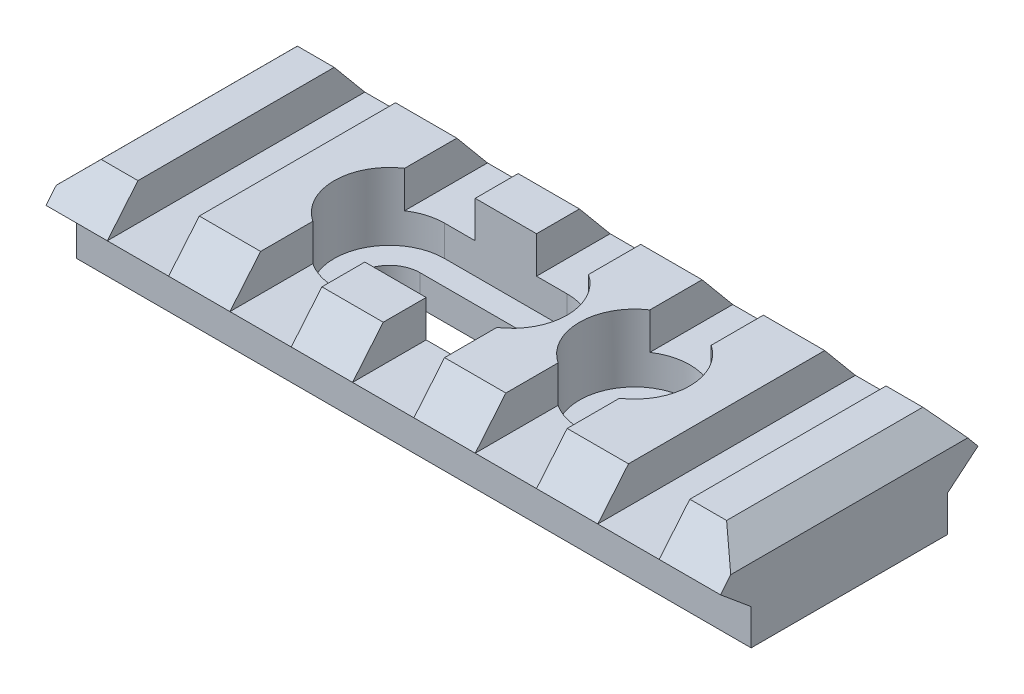
from build123d import *

# Parameters (mm, degrees)
EXTRUDE_1_DEPTH                  = 27.5
SKETCH_2_W                       = 5
SKETCH_2_H                       = 21
CUT_EXTRUDE_1_DEPTH              = 3
PATTERN_LINEAR_1_COUNT           = 3
PATTERN_LINEAR_1_PITCH           = 10
PATTERN_LINEAR_2_COPY_1_SKETCH_W = 5
PATTERN_LINEAR_2_COPY_1_SKETCH_H = 21
PATTERN_LINEAR_2_COPY_1_DEPTH    = 3
PATTERN_LINEAR_2_COPY_2_SKETCH_W = 5
PATTERN_LINEAR_2_COPY_2_SKETCH_H = 21
PATTERN_LINEAR_2_COPY_2_DEPTH    = 3
PATTERN_LINEAR_2_COPY_3_SKETCH_W = 5
PATTERN_LINEAR_2_COPY_3_SKETCH_H = 21
PATTERN_LINEAR_2_COPY_3_DEPTH    = 3
PATTERN_LINEAR_2_COPY_4_SKETCH_W = 5
PATTERN_LINEAR_2_COPY_4_SKETCH_H = 21
PATTERN_LINEAR_2_COPY_4_DEPTH    = 3
PATTERN_LINEAR_2_COPY_5_SKETCH_W = 5
PATTERN_LINEAR_2_COPY_5_SKETCH_H = 21
PATTERN_LINEAR_2_COPY_5_DEPTH    = 3
PATTERN_LINEAR_2_COPY_6_SKETCH_W = 5
PATTERN_LINEAR_2_COPY_6_SKETCH_H = 21
PATTERN_LINEAR_2_COPY_6_DEPTH    = 3
CUT_EXTRUDE_2_DEPTH              = 31.504098085
CUT_EXTRUDE_2_DEPTH_BACK         = 55
SKETCH_3_R                       = 2.5
CUT_EXTRUDE_3_DEPTH              = 31.504098085
SKETCH_5_R                       = 4.5
CUT_EXTRUDE_4_DEPTH              = 5.5


with BuildPart() as part:
    # 草图1 → 凸台-拉伸1 (new, symmetric)
    with BuildSketch(Plane(origin=(0, 0, 0), x_dir=(0, 0, -1), z_dir=(1, 0, 0))):
        Polygon((-8, 0), (8, 0), (8, 2.916666667), (10.5, 5), (8, 8), (-8, 8), (-10.5, 5), (-8, 2.916666667), align=None)
    extrude(amount=EXTRUDE_1_DEPTH, both=True)

    # 草图2 → 切除-拉伸1 (cut)
    with BuildSketch(Plane(origin=(0, 8, 0), x_dir=(1, 0, 0), z_dir=(0, 1, 0))):
        Rectangle(SKETCH_2_W, SKETCH_2_H)
    cut_extrude_1 = extrude(amount=-CUT_EXTRUDE_1_DEPTH, mode=Mode.SUBTRACT)

    # 阵列(线性)1: 切除-拉伸1 ×3
    with Locations(*[(i * PATTERN_LINEAR_1_PITCH, 0, 0) for i in range(1, PATTERN_LINEAR_1_COUNT)]):
        add(cut_extrude_1, mode=Mode.SUBTRACT)

    # 阵列(线性)2 copy 1 sketch → 阵列(线性)2 copy 1 (cut)
    with BuildSketch(Plane(origin=(0, 8, 0), x_dir=(1, 0, 0), z_dir=(0, 1, 0))):
        Rectangle(PATTERN_LINEAR_2_COPY_1_SKETCH_W, PATTERN_LINEAR_2_COPY_1_SKETCH_H)
    extrude(amount=-PATTERN_LINEAR_2_COPY_1_DEPTH, mode=Mode.SUBTRACT)

    # 阵列(线性)2 copy 2 sketch → 阵列(线性)2 copy 2 (cut)
    with BuildSketch(Plane(origin=(-10, 8, 0), x_dir=(1, 0, 0), z_dir=(0, 1, 0))):
        Rectangle(PATTERN_LINEAR_2_COPY_2_SKETCH_W, PATTERN_LINEAR_2_COPY_2_SKETCH_H)
    extrude(amount=-PATTERN_LINEAR_2_COPY_2_DEPTH, mode=Mode.SUBTRACT)

    # 阵列(线性)2 copy 3 sketch → 阵列(线性)2 copy 3 (cut)
    with BuildSketch(Plane(origin=(10, 8, 0), x_dir=(1, 0, 0), z_dir=(0, 1, 0))):
        Rectangle(PATTERN_LINEAR_2_COPY_3_SKETCH_W, PATTERN_LINEAR_2_COPY_3_SKETCH_H)
    extrude(amount=-PATTERN_LINEAR_2_COPY_3_DEPTH, mode=Mode.SUBTRACT)

    # 阵列(线性)2 copy 4 sketch → 阵列(线性)2 copy 4 (cut)
    with BuildSketch(Plane(origin=(0, 8, 0), x_dir=(1, 0, 0), z_dir=(0, 1, 0))):
        Rectangle(PATTERN_LINEAR_2_COPY_4_SKETCH_W, PATTERN_LINEAR_2_COPY_4_SKETCH_H)
    extrude(amount=-PATTERN_LINEAR_2_COPY_4_DEPTH, mode=Mode.SUBTRACT)

    # 阵列(线性)2 copy 5 sketch → 阵列(线性)2 copy 5 (cut)
    with BuildSketch(Plane(origin=(-10, 8, 0), x_dir=(1, 0, 0), z_dir=(0, 1, 0))):
        Rectangle(PATTERN_LINEAR_2_COPY_5_SKETCH_W, PATTERN_LINEAR_2_COPY_5_SKETCH_H)
    extrude(amount=-PATTERN_LINEAR_2_COPY_5_DEPTH, mode=Mode.SUBTRACT)

    # 阵列(线性)2 copy 6 sketch → 阵列(线性)2 copy 6 (cut)
    with BuildSketch(Plane(origin=(-20, 8, 0), x_dir=(1, 0, 0), z_dir=(0, 1, 0))):
        Rectangle(PATTERN_LINEAR_2_COPY_6_SKETCH_W, PATTERN_LINEAR_2_COPY_6_SKETCH_H)
    extrude(amount=-PATTERN_LINEAR_2_COPY_6_DEPTH, mode=Mode.SUBTRACT)

    # 草图3 → 切除-拉伸2 (cut, two sides: drawn at the far end of the back side and taken through both)
    with BuildSketch(Plane.XZ.offset(-CUT_EXTRUDE_2_DEPTH_BACK)):
        with Locations(Location((10, 0, 0), (0, 0, 90))):
            Circle(SKETCH_3_R)
        with BuildLine():
            Line((-10, 2.5), (0, 2.5))
            ThreePointArc((0, 2.5), (2.5, 0), (0, -2.5))
            Line((0, -2.5), (-10, -2.5))
            ThreePointArc((-10, -2.5), (-12.5, 0), (-10, 2.5))
        make_face()
    extrude(amount=CUT_EXTRUDE_2_DEPTH + CUT_EXTRUDE_2_DEPTH_BACK, mode=Mode.SUBTRACT)

    # 草图4 → 切除-拉伸3 (cut, symmetric)
    with BuildSketch(Plane.XY):
        Polygon((-27.5, 6.003638962), (-25.5, 8), (-27.5, 8), align=None)
    cut_extrude_3 = extrude(amount=CUT_EXTRUDE_3_DEPTH, both=True, mode=Mode.SUBTRACT)

    # 镜向1: 切除-拉伸3 across plane
    add(cut_extrude_3.mirror(Plane(origin=(0, 0, 0), x_dir=(0, 0, 1), z_dir=(1, 0, 0))), mode=Mode.SUBTRACT)

    # 草图5 → 切除-拉伸4 (cut)
    with BuildSketch(Plane(origin=(0, 8, 0), x_dir=(1, 0, 0), z_dir=(0, 1, 0))):
        with Locations(Location((10, 0, 0), (0, 0, 270))):
            Circle(SKETCH_5_R)
        with BuildLine():
            Line((-10, 4.5), (0, 4.5))
            ThreePointArc((0, 4.5), (4.5, 0), (0, -4.5))
            Line((0, -4.5), (-10, -4.5))
            ThreePointArc((-10, -4.5), (-14.5, 0), (-10, 4.5))
        make_face()
    extrude(amount=-CUT_EXTRUDE_4_DEPTH, mode=Mode.SUBTRACT)


solid = part.part
